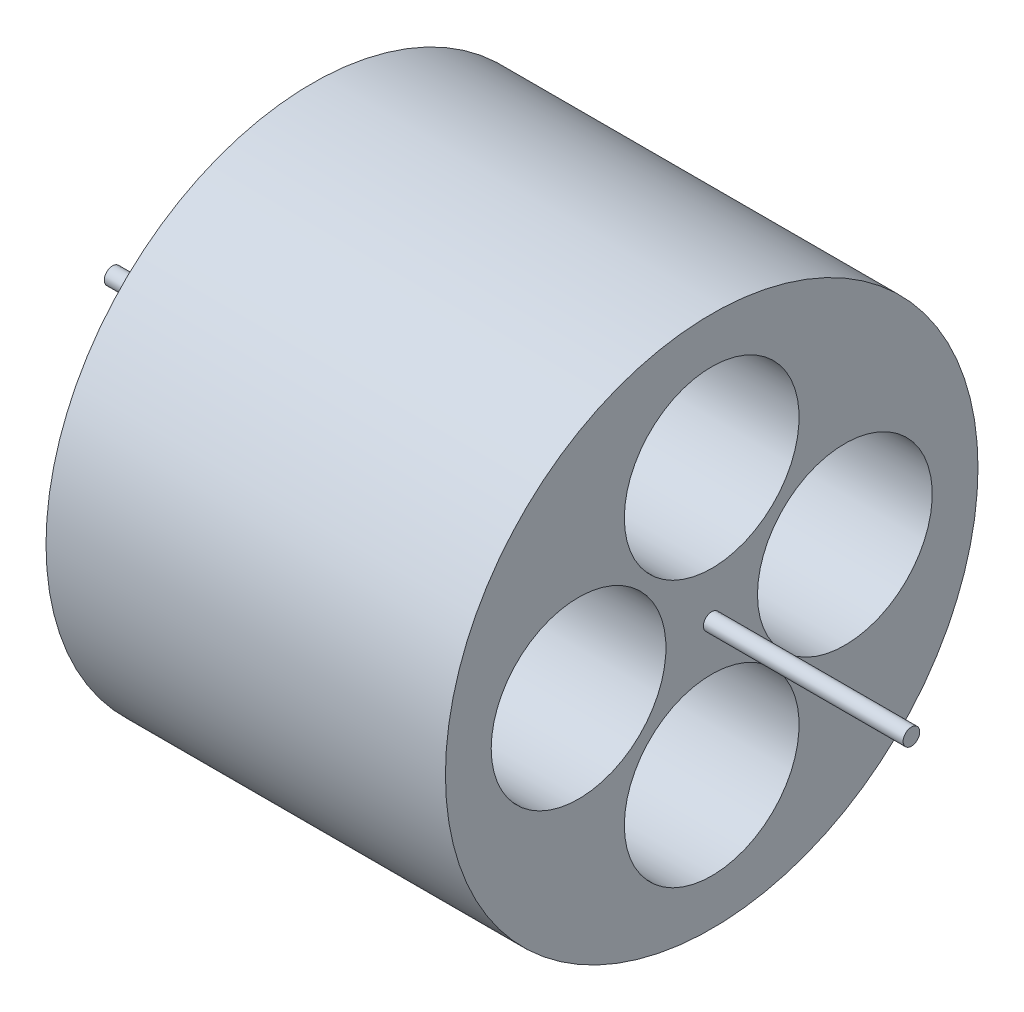
from build123d import *

# Parameters (mm, degrees)
SKETCH1_R                = 101.6
BOSS_EXTRUDE1_DEPTH      = 152.4
SKETCH3_R                = 33.3375
CUT_EXTRUDE1_DEPTH       = 210.453765781
CIRPATTERN1_COUNT        = 4
BOSS_EXTRUDE7_DEPTH      = 228.6
BOSS_EXTRUDE7_DEPTH_BACK = 76.2
SKETCH2_R                = 3.175


with BuildPart() as part:
    # Sketch1 → Boss-Extrude1 (new body)
    with BuildSketch(Plane(origin=(0, 0, 0), x_dir=(0, 0, -1), z_dir=(1, 0, 0))):
        with Locations(Location((0, 0, 0), (0, 0, 180))):
            Circle(SKETCH1_R)
    extrude(amount=BOSS_EXTRUDE1_DEPTH)

    # Sketch3 → Cut-Extrude1 (cut, through all)
    with BuildSketch(Plane(origin=(0, 0, 0), x_dir=(0, 0, -1), z_dir=(1, 0, 0))):
        with Locations(Location((50.8, 0, 0), (0, 0, 180))):
            Circle(SKETCH3_R)
    cut_extrude1 = extrude(amount=CUT_EXTRUDE1_DEPTH, mode=Mode.SUBTRACT)

    # CirPattern1: Cut-Extrude1 ×4 about axis
    cirpattern1_axis = Axis((0, 0, 0), (1, 0, 0))
    for i in range(1, CIRPATTERN1_COUNT):
        add(cut_extrude1.rotate(cirpattern1_axis, i * 360 / CIRPATTERN1_COUNT), mode=Mode.SUBTRACT)

    # Sketch2 → Boss-Extrude7 (add, two sides: drawn at the far end of the back side and taken through both)
    with BuildSketch(Plane(origin=(0, 0, 0), x_dir=(0, 0, -1), z_dir=(1, 0, 0)).offset(-BOSS_EXTRUDE7_DEPTH_BACK)):
        Circle(SKETCH2_R)
    extrude(amount=BOSS_EXTRUDE7_DEPTH + BOSS_EXTRUDE7_DEPTH_BACK)


solid = part.part
